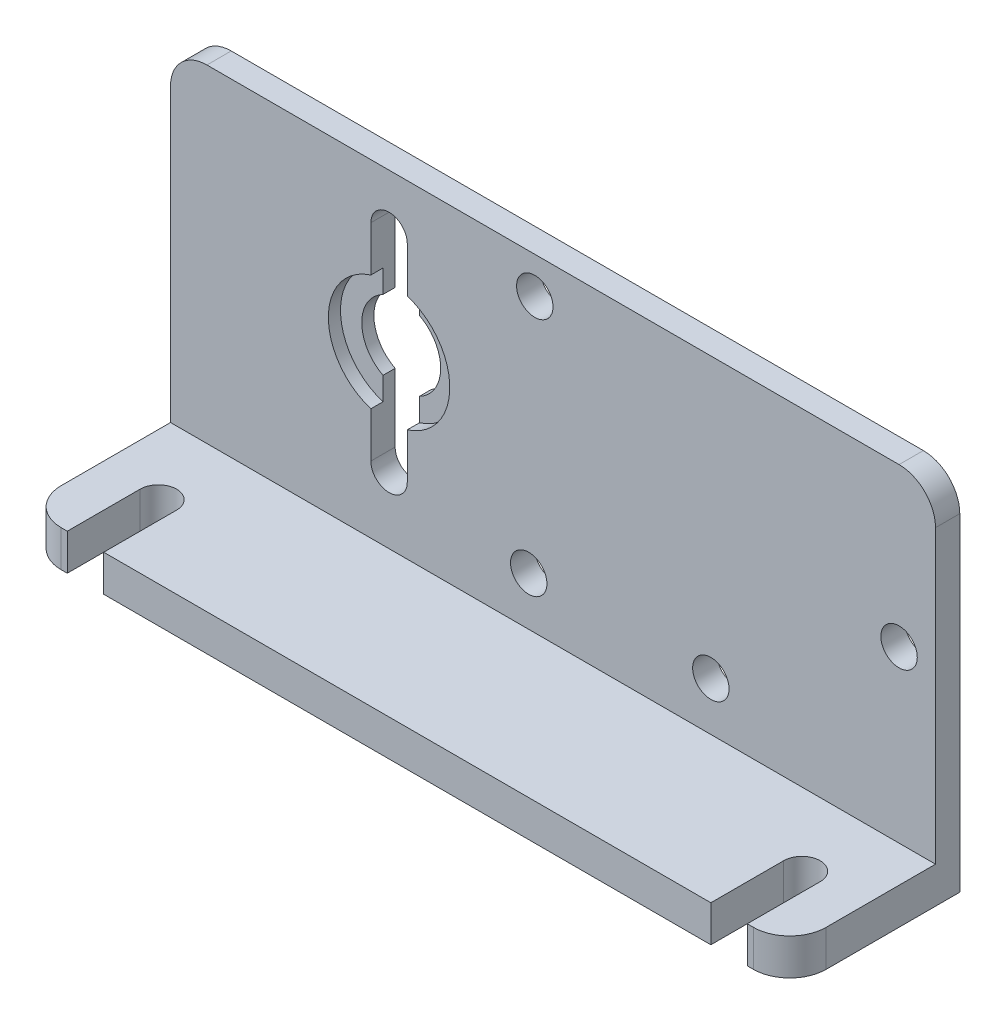
from build123d import *

# Parameters (mm, degrees)
SKETCH1_W           = 63
SKETCH1_H           = 30
BOSS_EXTRUDE1_DEPTH = 2
SKETCH2_W           = 63
SKETCH2_H           = 3
BOSS_EXTRUDE2_DEPTH = 12
CUT_EXTRUDE1_DEPTH  = 44.786413418
FILLET1_R           = 3
CUT_EXTRUDE2_DEPTH  = 37.895121629
SKETCH5_R           = 5
CUT_EXTRUDE3_DEPTH  = 1
SKETCH6_R           = 3.25
CUT_EXTRUDE4_DEPTH  = 38.232378382
SKETCH7_R           = 1.5
CUT_EXTRUDE5_DEPTH  = 37.895121629


with BuildPart() as part:
    # Sketch1 → Boss-Extrude1 (new body)
    with BuildSketch(Plane.XY):
        Rectangle(SKETCH1_W, SKETCH1_H)
    extrude(amount=BOSS_EXTRUDE1_DEPTH)

    # Sketch2 → Boss-Extrude2 (add)
    with BuildSketch(Plane.XY.offset(2)):
        with Locations((0, -13.5)):
            Rectangle(SKETCH2_W, SKETCH2_H)
    extrude(amount=BOSS_EXTRUDE2_DEPTH)

    # Sketch3 → Cut-Extrude1 (cut, through all)
    with BuildSketch(Plane(origin=(0, -12, 0), x_dir=(1, 0, 0), z_dir=(0, 1, 0))):
        with BuildLine():
            Line((25, -14), (25, -8))
            ThreePointArc((25, -8), (26.5, -6.5), (28, -8))
            Line((28, -8), (28, -14))
            ThreePointArc((28, -14), (26.5, -15.5), (25, -14))
        make_face()
        with BuildLine():
            Line((-25, -14), (-25, -8))
            ThreePointArc((-25, -8), (-26.5, -6.5), (-28, -8))
            Line((-28, -8), (-28, -14))
            ThreePointArc((-28, -14), (-26.5, -15.5), (-25, -14))
        make_face()
    extrude(amount=-CUT_EXTRUDE1_DEPTH, mode=Mode.SUBTRACT)

    # Fillet1
    fillet1_edges = [part.edges().sort_by_distance(p)[0] for p in [
        (-31.5, -13.5, 14),
        (31.5, -13.5, 14),
        (-31.5, 15, 1),
        (31.5, 15, 1),
    ]]
    fillet(fillet1_edges, radius=FILLET1_R)

    # Sketch4 → Cut-Extrude2 (cut, through all)
    with BuildSketch(Plane.XY.offset(2)):
        with BuildLine():
            Line((-12, 10.5), (-12, -6.5))
            ThreePointArc((-12, -6.5), (-13.5, -8), (-15, -6.5))
            Line((-15, -6.5), (-15, 10.5))
            ThreePointArc((-15, 10.5), (-13.5, 12), (-12, 10.5))
        make_face()
    extrude(amount=-CUT_EXTRUDE2_DEPTH, mode=Mode.SUBTRACT)

    # Sketch5 → Cut-Extrude3 (cut)
    with BuildSketch(Plane.XY.offset(2)):
        with Locations((-13.5, 2)):
            Circle(SKETCH5_R)
    extrude(amount=-CUT_EXTRUDE3_DEPTH, mode=Mode.SUBTRACT)

    # Sketch6 → Cut-Extrude4 (cut, through all)
    with BuildSketch(Plane.XY.offset(1)):
        with Locations((-13.5, 2)):
            Circle(SKETCH6_R)
    extrude(amount=-CUT_EXTRUDE4_DEPTH, mode=Mode.SUBTRACT)

    # Sketch7 → Cut-Extrude5 (cut, through all)
    with BuildSketch(Plane.XY.offset(2)):
        with Locations((28.5, 2)):
            Circle(SKETCH7_R)
        with Locations((-1.5, 12)):
            Circle(SKETCH7_R)
        with Locations((-2, -8)):
            Circle(SKETCH7_R)
        with Locations((13, -8)):
            Circle(SKETCH7_R)
    extrude(amount=-CUT_EXTRUDE5_DEPTH, mode=Mode.SUBTRACT)


solid = part.part
